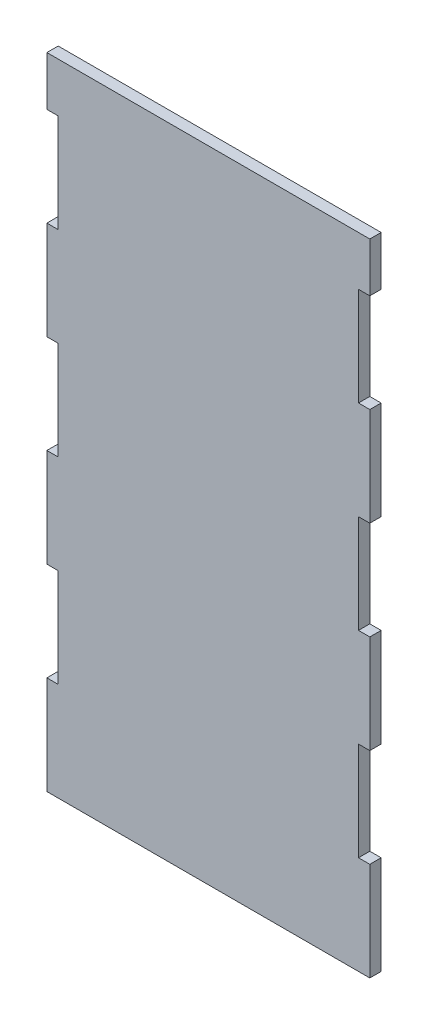
from build123d import *

# Parameters (mm, degrees)
SKETCH1_W           = 83.312
SKETCH1_H           = 165.1
BOSS_EXTRUDE1_DEPTH = 1.4605
SKETCH2_W           = 2.921
SKETCH2_H           = 25.4
CUT_EXTRUDE1_DEPTH  = 2.921


with BuildPart() as part:
    # Sketch1 → Boss-Extrude1 (new, symmetric)
    with BuildSketch(Plane.XY):
        Rectangle(SKETCH1_W, SKETCH1_H)
    extrude(amount=BOSS_EXTRUDE1_DEPTH, both=True)

    # Sketch2 → Cut-Extrude1 (cut)
    with BuildSketch(Plane.XY.offset(1.4605)):
        with Locations((-40.1955, 57.15)):
            Rectangle(SKETCH2_W, SKETCH2_H)
        with Locations((-40.1955, 6.35)):
            Rectangle(SKETCH2_W, SKETCH2_H)
        with Locations((-40.1955, -44.45)):
            Rectangle(SKETCH2_W, SKETCH2_H)
        with Locations((40.1955, -44.45)):
            Rectangle(SKETCH2_W, SKETCH2_H)
        with Locations((40.1955, 6.35)):
            Rectangle(SKETCH2_W, SKETCH2_H)
        with Locations((40.1955, 57.15)):
            Rectangle(SKETCH2_W, SKETCH2_H)
    extrude(amount=-CUT_EXTRUDE1_DEPTH, mode=Mode.SUBTRACT)


solid = part.part
